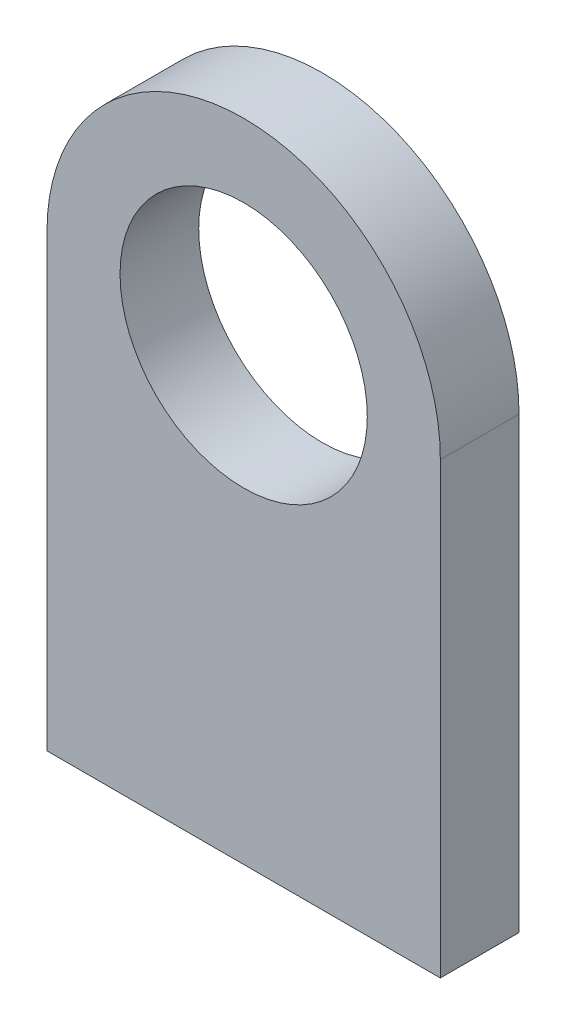
from build123d import *

# Parameters (mm, degrees)
ESBO_O1_R                = 11
RESSALTO_EXTRUS_O1_DEPTH = 7


with BuildPart() as part:
    # Esboço1 → Ressalto-extrusão1 (new body)
    with BuildSketch(Plane.XY):
        with BuildLine():
            Line((-17.5, -40), (17.5, -40))
            Line((17.5, -40), (17.5, -0.0537741))
            ThreePointArc((17.5, -0.0537741), (0.0537741, 17.5), (-17.5, 0.0537741))
            Line((-17.5, 0.0537741), (-17.5, -40))
        make_face()
        Circle(ESBO_O1_R, mode=Mode.SUBTRACT)
    extrude(amount=RESSALTO_EXTRUS_O1_DEPTH)


solid = part.part
